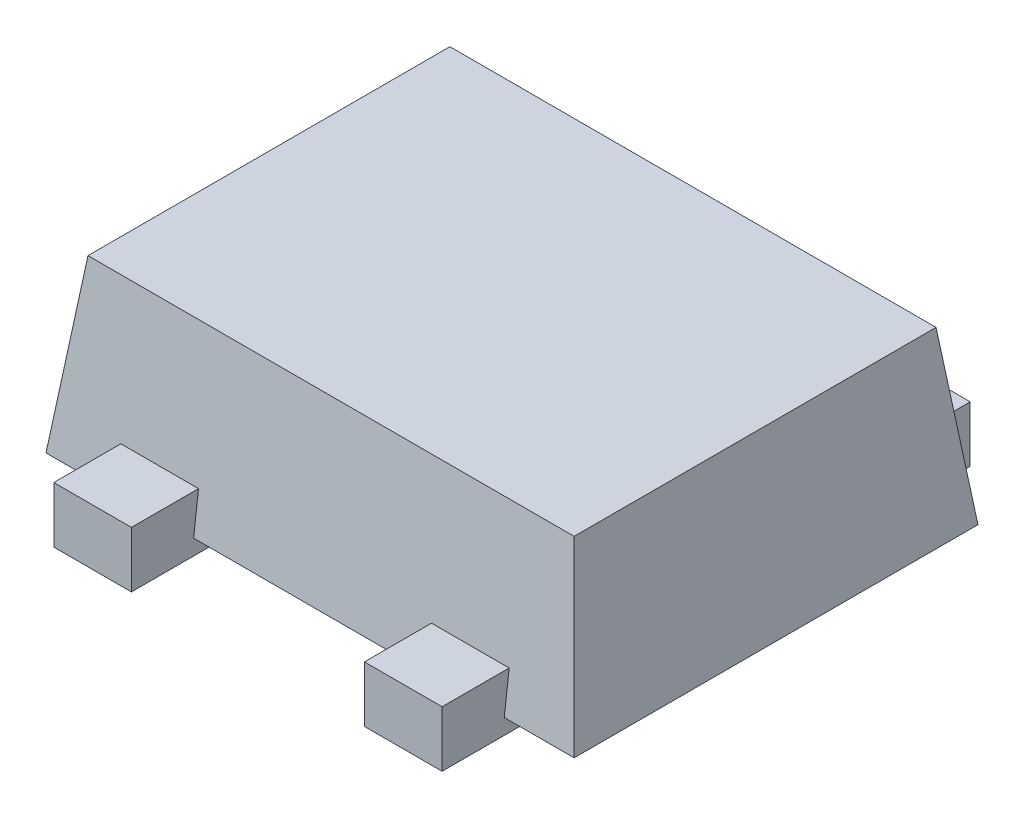
from build123d import *

# Parameters (mm, degrees)
CROQUIS1_W              = 1.7
CROQUIS1_H              = 1.3
SALIENTE_EXTRUIR1_DEPTH = 0.55
SALIENTE_EXTRUIR1_TAPER = 7
CROQUIS3_W              = 0.25
CROQUIS3_H              = 0.18
SALIENTE_EXTRUIR2_DEPTH = 0.4
MATRIZL1_COUNT          = 2
MATRIZL1_PITCH          = 0.5
MATRIZL2_COUNT          = 2
MATRIZL2_PITCH          = 0.5
CROQUIS6_W              = 0.25
CROQUIS6_H              = 0.18
SALIENTE_EXTRUIR3_DEPTH = 0.4
MATRIZL3_COUNT          = 2
MATRIZL3_PITCH          = 1


with BuildPart() as part:
    # Croquis1 → Saliente-Extruir1 (new body)
    with BuildSketch(Plane(origin=(0, 0, 0), x_dir=(1, 0, 0), z_dir=(0, 1, 0))):
        Rectangle(CROQUIS1_W, CROQUIS1_H)
    extrude(amount=SALIENTE_EXTRUIR1_DEPTH, taper=SALIENTE_EXTRUIR1_TAPER)


with BuildPart() as body_2:
    # Croquis3 → Saliente-Extruir2 (new body)
    with BuildSketch(Plane(origin=(0, 0.04, -0.85), x_dir=(-1, 0, 0), z_dir=(0, 0, -1))):
        Rectangle(CROQUIS3_W, CROQUIS3_H)
    saliente_extruir2 = extrude(amount=-SALIENTE_EXTRUIR2_DEPTH)


with BuildPart() as matrizl1_1:
    # MatrizL1: Saliente-Extruir2 ×2
    with Locations(*[(i * MATRIZL1_PITCH, 0, 0) for i in range(1, MATRIZL1_COUNT)]):
        add(saliente_extruir2)


with BuildPart() as matrizl2_1:
    # MatrizL2: Saliente-Extruir2 ×2
    with Locations(*[(-i * MATRIZL2_PITCH, 0, 0) for i in range(1, MATRIZL2_COUNT)]):
        add(saliente_extruir2)


with BuildPart() as body_5:
    # Croquis6 → Saliente-Extruir3 (new body)
    with BuildSketch(Plane(origin=(0.5, 0.04, 0.85), x_dir=(1, 0, 0), z_dir=(0, 0, 1))):
        Rectangle(CROQUIS6_W, CROQUIS6_H)
    saliente_extruir3 = extrude(amount=-SALIENTE_EXTRUIR3_DEPTH)


with BuildPart() as matrizl3_1:
    # MatrizL3: Saliente-Extruir3 ×2
    with Locations(*[(-i * MATRIZL3_PITCH, 0, 0) for i in range(1, MATRIZL3_COUNT)]):
        add(saliente_extruir3)


solid = Compound([part.part, body_2.part, matrizl1_1.part, matrizl2_1.part, body_5.part, matrizl3_1.part])
